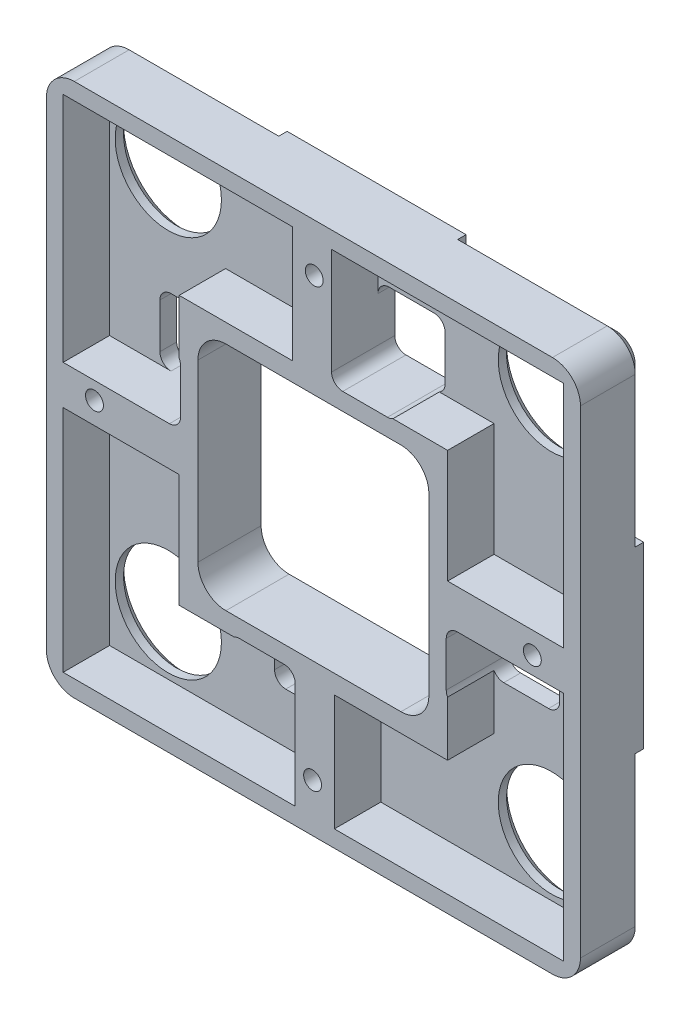
from build123d import *

# Parameters (mm, degrees)
SKETCH_1_W                = 95.5
SKETCH_1_H                = 95.5
SKETCH_1_R                = 9.5
EXTRUDE_1_DEPTH           = 3
SKETCH_3_W                = 42
SKETCH_3_H                = 42
CUT_EXTRUDE_2_DEPTH       = 68.595303091
SKETCH_5_W                = 95.5
SKETCH_5_H                = 95.5
SKETCH_5_W_2              = 89.5
SKETCH_5_H_2              = 89.5
EXTRUDE_2_DEPTH           = 8.3
FILLET_1_R                = 5
SKETCH_7_W                = 48
SKETCH_7_H                = 48
SKETCH_7_W_2              = 42
SKETCH_7_H_2              = 42
EXTRUDE_4_DEPTH           = 8.3
CHAMFER_3_SIZE            = 1.5
CHAMFER_5_SIZE            = 1.5
SKETCH_12_R               = 1.6
CUT_EXTRUDE_8_DEPTH       = 69.467620084
SKETCH_13_W               = 20.75
SKETCH_13_H               = 7
SKETCH_13_W_2             = 7
SKETCH_13_H_2             = 20.75
EXTRUDE_5_DEPTH           = 8.3
SKETCH_14_R               = 1.6
CUT_EXTRUDE_9_DEPTH       = 69.467620084
EXTRUDE_6_REACH           = 70.468
SKETCH_15_W               = 32
SKETCH_15_H               = 1.5
SKETCH_15_W_2             = 1.5
SKETCH_15_H_2             = 32
CUT_EXTRUDE_10_DEPTH      = 69.036865007
CUT_EXTRUDE_10_DEPTH_BACK = 69.036865007
SKETCH_16_W               = 12
SKETCH_16_H               = 12
SKETCH_17_W               = 42
SKETCH_17_H               = 42
EXTRUDE_7_DEPTH           = 11.3
FILLET_2_R                = 2
SKETCH_18_W               = 41.3
SKETCH_18_H               = 41.3
CUT_EXTRUDE_11_DEPTH      = 69.467620084
FILLET_3_R                = 5


with BuildPart() as part:
    # ｽｹｯﾁ1 → ﾎﾞｽ - 押し出し1 (new body)
    with BuildSketch(Plane.XY):
        Rectangle(SKETCH_1_W, SKETCH_1_H)
        with Locations((-34.25, 34.25)):
            Circle(SKETCH_1_R, mode=Mode.SUBTRACT)
        with Locations((34.25, 34.25)):
            Circle(SKETCH_1_R, mode=Mode.SUBTRACT)
        with Locations((34.25, -34.25)):
            Circle(SKETCH_1_R, mode=Mode.SUBTRACT)
        with Locations((-34.25, -34.25)):
            Circle(SKETCH_1_R, mode=Mode.SUBTRACT)
    extrude(amount=EXTRUDE_1_DEPTH)

    # ｽｹｯﾁ3 → ｶｯﾄ - 押し出し2 (cut, through all)
    with BuildSketch(Plane.XY.offset(3)):
        Rectangle(SKETCH_3_W, SKETCH_3_H)
    extrude(amount=-CUT_EXTRUDE_2_DEPTH, mode=Mode.SUBTRACT)

    # ｽｹｯﾁ5 → ﾎﾞｽ - 押し出し2 (add)
    with BuildSketch(Plane.XY.offset(3)):
        Rectangle(SKETCH_5_W, SKETCH_5_H)
        Rectangle(SKETCH_5_W_2, SKETCH_5_H_2, mode=Mode.SUBTRACT)
    extrude(amount=EXTRUDE_2_DEPTH)

    # ﾌｨﾚｯﾄ1
    fillet_1_edges = [part.edges().sort_by_distance(p)[0] for p in [
        (-47.75, 47.75, 5.65),
        (47.75, 47.75, 5.65),
        (47.75, -47.75, 5.65),
        (-47.75, -47.75, 5.65),
    ]]
    fillet(fillet_1_edges, radius=FILLET_1_R)

    # ｽｹｯﾁ7 → ﾎﾞｽ - 押し出し4 (add)
    with BuildSketch(Plane.XY.offset(3)):
        Rectangle(SKETCH_7_W, SKETCH_7_H)
        Rectangle(SKETCH_7_W_2, SKETCH_7_H_2, mode=Mode.SUBTRACT)
    extrude(amount=EXTRUDE_4_DEPTH)

    # 面取り3
    chamfer_3_edges = [part.edges().sort_by_distance(p)[0] for p in [
        (47.75, 0, 0),
        (-47.75, 0, 0),
        (0, 47.75, 0),
        (0, -47.75, 0),
        (-46.285533906, 46.285533906, 0),
        (46.285533906, 46.285533906, 0),
        (-46.285533906, -46.285533906, 0),
        (46.285533906, -46.285533906, 0),
    ]]
    chamfer(chamfer_3_edges, length=CHAMFER_3_SIZE)

    # 面取り5
    chamfer_5_edges = [part.edges().sort_by_distance(p)[0] for p in [
        (-43.75, 34.25, 0),
        (24.75, 34.25, 0),
        (24.75, -34.25, 0),
        (-43.75, -34.25, 0),
    ]]
    chamfer(chamfer_5_edges, length=CHAMFER_5_SIZE)

    # ｽｹｯﾁ12 → ｶｯﾄ - 押し出し8 (cut, through all)
    with BuildSketch(Plane(origin=(0, 0, 0), x_dir=(-1, 0, 0), z_dir=(0, 0, -1))):
        with Locations((-0.15, 39.15)):
            Circle(SKETCH_12_R)
        with Locations((-39.15, -0.15)):
            Circle(SKETCH_12_R)
        with Locations((39.15, 0.15)):
            Circle(SKETCH_12_R)
        with Locations((0.15, -39.15)):
            Circle(SKETCH_12_R)
    extrude(amount=-CUT_EXTRUDE_8_DEPTH, mode=Mode.SUBTRACT)

    # ｽｹｯﾁ13 → ﾎﾞｽ - 押し出し5 (add)
    with BuildSketch(Plane.XY.offset(3)):
        with Locations((-34.375, -0.25)):
            Rectangle(SKETCH_13_W, SKETCH_13_H)
        with Locations((0.25, -34.375)):
            Rectangle(SKETCH_13_W_2, SKETCH_13_H_2)
        with Locations((34.375, 0.25)):
            Rectangle(SKETCH_13_W, SKETCH_13_H)
        with Locations((-0.25, 34.375)):
            Rectangle(SKETCH_13_W_2, SKETCH_13_H_2)
    extrude(amount=EXTRUDE_5_DEPTH)

    # ｽｹｯﾁ14 → ｶｯﾄ - 押し出し9 (cut, through all)
    with BuildSketch(Plane.XY.offset(11.3)):
        with Locations(Location((-39.15, 0.15, 0), (0, 0, 180))):
            Circle(SKETCH_14_R)
        with Locations(Location((-0.15, -39.15, 0), (0, 0, 180))):
            Circle(SKETCH_14_R)
        with Locations(Location((39.15, -0.15, 0), (0, 0, 180))):
            Circle(SKETCH_14_R)
        with Locations(Location((0.15, 39.15, 0), (0, 0, 180))):
            Circle(SKETCH_14_R)
    extrude(amount=-CUT_EXTRUDE_9_DEPTH, mode=Mode.SUBTRACT)

    # ﾎﾞｽ - 押し出し6: up to this face of the body (flat: up to its plane)
    extrude_6_end = Plane(part.part.faces().sort_by_distance((0, -46.399426048, 11.3))[0])
    # ｽｹｯﾁ15 → ﾎﾞｽ - 押し出し6 (add, up to the picked face)
    with BuildSketch(Plane(origin=(0, 0, 0), x_dir=(-1, 0, 0), z_dir=(0, 0, -1)), mode=Mode.PRIVATE) as extrude_6_sk1:
        with Locations((0, 47)):
            Rectangle(SKETCH_15_W, SKETCH_15_H)
    extrude_6_tool1 = split(extrude(extrude_6_sk1.sketch, amount=-EXTRUDE_6_REACH, mode=Mode.PRIVATE), bisect_by=extrude_6_end, keep=Keep.BOTH, mode=Mode.PRIVATE)
    # ｽｹｯﾁ15 → ﾎﾞｽ - 押し出し6 (add, up to the picked face)
    with BuildSketch(Plane(origin=(0, 0, 0), x_dir=(-1, 0, 0), z_dir=(0, 0, -1)), mode=Mode.PRIVATE) as extrude_6_sk2:
        with Locations((47, 0)):
            Rectangle(SKETCH_15_W_2, SKETCH_15_H_2)
    extrude_6_tool2 = split(extrude(extrude_6_sk2.sketch, amount=-EXTRUDE_6_REACH, mode=Mode.PRIVATE), bisect_by=extrude_6_end, keep=Keep.BOTH, mode=Mode.PRIVATE)
    # ｽｹｯﾁ15 → ﾎﾞｽ - 押し出し6 (add, up to the picked face)
    with BuildSketch(Plane(origin=(0, 0, 0), x_dir=(-1, 0, 0), z_dir=(0, 0, -1)), mode=Mode.PRIVATE) as extrude_6_sk3:
        with Locations((0, -47)):
            Rectangle(SKETCH_15_W, SKETCH_15_H)
    extrude_6_tool3 = split(extrude(extrude_6_sk3.sketch, amount=-EXTRUDE_6_REACH, mode=Mode.PRIVATE), bisect_by=extrude_6_end, keep=Keep.BOTH, mode=Mode.PRIVATE)
    # ｽｹｯﾁ15 → ﾎﾞｽ - 押し出し6 (add, up to the picked face)
    with BuildSketch(Plane(origin=(0, 0, 0), x_dir=(-1, 0, 0), z_dir=(0, 0, -1)), mode=Mode.PRIVATE) as extrude_6_sk4:
        with Locations((-47, 0)):
            Rectangle(SKETCH_15_W_2, SKETCH_15_H_2)
    extrude_6_tool4 = split(extrude(extrude_6_sk4.sketch, amount=-EXTRUDE_6_REACH, mode=Mode.PRIVATE), bisect_by=extrude_6_end, keep=Keep.BOTH, mode=Mode.PRIVATE)
    add(extrude_6_tool1.solids().sort_by(Axis((0, 47, 0), (0, 0, 1)))[0])
    add(extrude_6_tool2.solids().sort_by(Axis((-47, 0, 0), (0, 0, 1)))[0])
    add(extrude_6_tool3.solids().sort_by(Axis((0, -47, 0), (0, 0, 1)))[0])
    add(extrude_6_tool4.solids().sort_by(Axis((47, 0, 0), (0, 0, 1)))[0])

    # ｽｹｯﾁ16 → ｶｯﾄ - 押し出し10 (cut, two sides: drawn at the far end of the back side and taken through both)
    with BuildSketch(Plane.XY.offset(3).offset(-CUT_EXTRUDE_10_DEPTH_BACK)):
        with Locations((9.25, 29.75)):
            Rectangle(SKETCH_16_W, SKETCH_16_H)
        with Locations((29.75, -9.25)):
            Rectangle(SKETCH_16_W, SKETCH_16_H)
        with Locations((-9.25, -29.75)):
            Rectangle(SKETCH_16_W, SKETCH_16_H)
        with Locations((-29.75, 9.25)):
            Rectangle(SKETCH_16_W, SKETCH_16_H)
    extrude(amount=CUT_EXTRUDE_10_DEPTH + CUT_EXTRUDE_10_DEPTH_BACK, mode=Mode.SUBTRACT)

    # ｽｹｯﾁ17 → ﾎﾞｽ - 押し出し7 (add, through all)
    with BuildSketch(Plane(origin=(0, 0, 0), x_dir=(-1, 0, 0), z_dir=(0, 0, -1))):
        Rectangle(SKETCH_17_W, SKETCH_17_H)
    extrude(amount=-EXTRUDE_7_DEPTH)

    # ﾌｨﾚｯﾄ2
    fillet_2_edges = [part.edges().sort_by_distance(p)[0] for p in [
        (3.25, 35.75, 1.5),
        (15.25, 35.75, 1.5),
        (15.25, 23.75, 5.65),
        (3.25, 23.75, 5.65),
        (-35.75, 15.25, 1.5),
        (-35.75, 3.25, 1.5),
        (-23.75, 3.25, 5.65),
        (-23.75, 15.25, 5.65),
        (-15.25, -23.75, 5.65),
        (-3.25, -23.75, 5.65),
        (-3.25, -35.75, 1.5),
        (-15.25, -35.75, 1.5),
        (23.75, -15.25, 5.65),
        (35.75, -15.25, 1.5),
        (35.75, -3.25, 1.5),
        (23.75, -3.25, 5.65),
    ]]
    fillet(fillet_2_edges, radius=FILLET_2_R)

    # ｽｹｯﾁ18 → ｶｯﾄ - 押し出し11 (cut, through all)
    with BuildSketch(Plane(origin=(0, 0, 0), x_dir=(-1, 0, 0), z_dir=(0, 0, -1))):
        Rectangle(SKETCH_18_W, SKETCH_18_H)
    extrude(amount=-CUT_EXTRUDE_11_DEPTH, mode=Mode.SUBTRACT)

    # ﾌｨﾚｯﾄ3
    fillet_3_edges = [part.edges().sort_by_distance(p)[0] for p in [
        (-20.65, 20.65, 5.65),
        (-20.65, -20.65, 5.65),
        (20.65, -20.65, 5.65),
        (20.65, 20.65, 5.65),
    ]]
    fillet(fillet_3_edges, radius=FILLET_3_R)


solid = part.part
